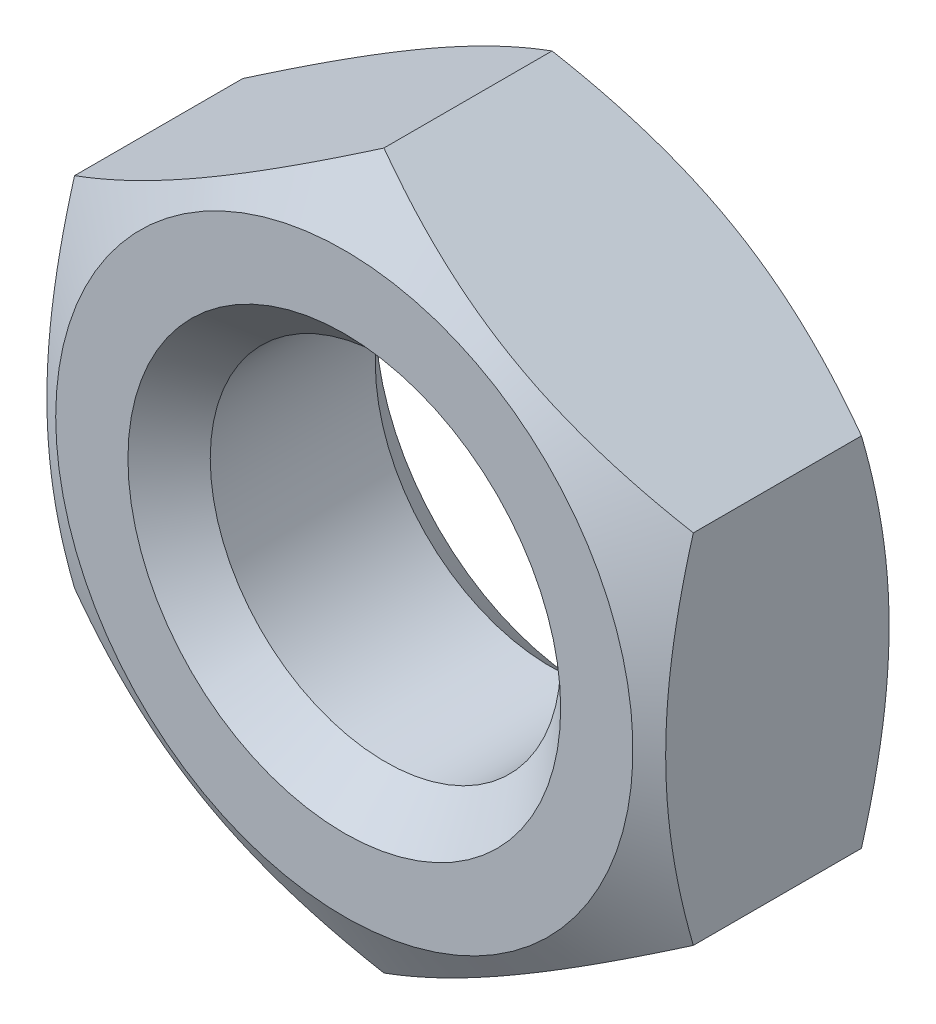
from build123d import *

# Parameters (mm, degrees)
SKETCH2_OUTSIDE_W  = 42.93
SKETCH2_OUTSIDE_H  = 42.93
CUT_EXTRUDE2_DEPTH = 25.4


with BuildPart() as part:
    # Sketch1 → Revolve1 (revolve)
    with BuildSketch(Plane(origin=(0, 0, 0), x_dir=(0, 0, -1), z_dir=(1, 0, 0)), mode=Mode.PRIVATE) as revolve1_sk:
        Polygon((-1.584325, 6.746875), (-7.940675, 6.746875), (-9.525, 8.3312), (-9.525, 11.1125), (-6.775369343, 15.875), (-2.749630657, 15.875), (0, 11.1125), (0, 8.3312), align=None)
    revolve(revolve1_sk.sketch.rotate(Axis((0, 0, -10.380814409), (0, 0, 1)), 90), axis=Axis((0, 0, -10.380814409), (0, 0, 1)))

    # Sketch2 outside → Cut-Extrude2 (cut)
    with BuildSketch(Plane.XY):
        Rectangle(SKETCH2_OUTSIDE_W, SKETCH2_OUTSIDE_H)
        Polygon((0, 13.755485633), (-11.9126, 6.877742817), (-11.9126, -6.877742817), (0, -13.755485633), (11.9126, -6.877742817), (11.9126, 6.877742817), align=None, mode=Mode.SUBTRACT)
    extrude(amount=CUT_EXTRUDE2_DEPTH, mode=Mode.SUBTRACT)


solid = part.part
